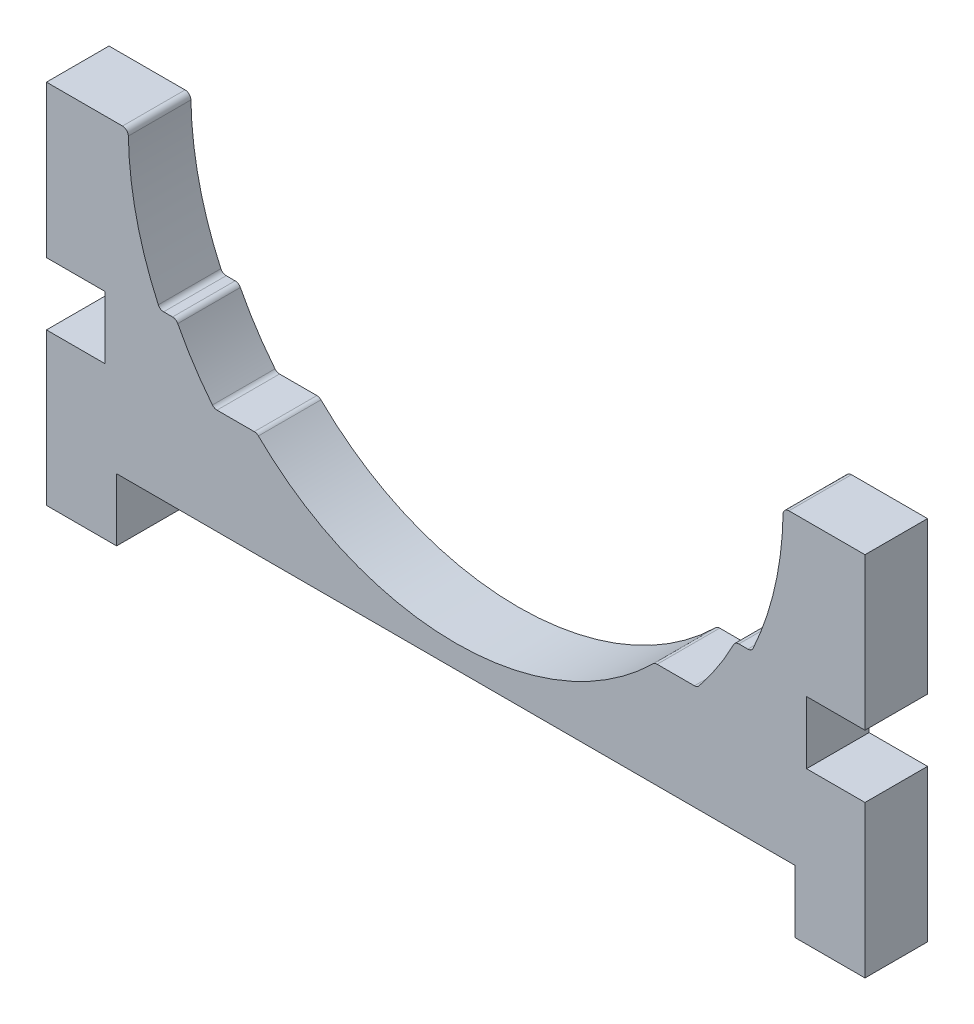
from build123d import *

# Parameters (mm, degrees)
BOSS_EXTRUDE1_DEPTH = 5.35


with BuildPart() as part:
    # Model → Boss-Extrude1 (new body)
    with BuildSketch(Plane.XY):
        with BuildLine():
            Line((-29, 0), (29, 0))
            Line((29, 0), (29, -5.35))
            Line((29, -5.35), (35, -5.35))
            Line((35, -5.35), (35, -1.30660388))
            Line((35, -1.30660388), (35, 7.65))
            Line((35, 7.65), (30, 7.65))
            Line((30, 7.65), (30, 13))
            Line((30, 13), (35, 13))
            Line((35, 13), (35, 26))
            Line((35, 26), (28.495613698, 26))
            ThreePointArc((28.495613698, 26), (28.145175376, 25.856641252), (27.99569065, 25.50877193))
            ThreePointArc((27.99569065, 25.50877193), (27.297393866, 19.766839637), (25.434173666, 14.290909091))
            ThreePointArc((25.434173666, 14.290909091), (25.249671939, 14.078962321), (24.979991994, 14))
            Line((24.979991994, 14), (24.213890642, 14))
            ThreePointArc((24.213890642, 14), (23.953774224, 13.927012236), (23.76959907, 13.729357798))
            ThreePointArc((23.76959907, 13.729357798), (22.402719166, 11.382179575), (20.804862314, 9.185714286))
            ThreePointArc((20.804862314, 9.185714286), (20.631459285, 9.048811094), (20.415986383, 9))
            Line((20.415986383, 9), (17.224924528, 9))
            ThreePointArc((17.224924528, 9), (17.035413911, 8.962693987), (16.874182835, 8.856342904))
            ThreePointArc((16.874182835, 8.856342904), (0, 1.945), (-16.874182835, 8.856342904))
            ThreePointArc((-16.874182835, 8.856342904), (-17.035413911, 8.962693987), (-17.224924528, 9))
            Line((-17.224924528, 9), (-20.415986383, 9))
            ThreePointArc((-20.415986383, 9), (-20.631459285, 9.048811094), (-20.804862314, 9.185714286))
            ThreePointArc((-20.804862314, 9.185714286), (-22.402719166, 11.382179575), (-23.76959907, 13.729357798))
            ThreePointArc((-23.76959907, 13.729357798), (-23.953774224, 13.927012236), (-24.213890642, 14))
            Line((-24.213890642, 14), (-24.979991994, 14))
            ThreePointArc((-24.979991994, 14), (-25.249671939, 14.078962321), (-25.434173666, 14.290909091))
            ThreePointArc((-25.434173666, 14.290909091), (-27.297393866, 19.766839637), (-27.99569065, 25.50877193))
            ThreePointArc((-27.99569065, 25.50877193), (-28.145175376, 25.856641252), (-28.495613698, 26))
            Line((-28.495613698, 26), (-35, 26))
            Line((-35, 26), (-35, 13))
            Line((-35, 13), (-30, 13))
            Line((-30, 13), (-30, 7.65))
            Line((-30, 7.65), (-35, 7.65))
            Line((-35, 7.65), (-35, -1.30660388))
            Line((-35, -1.30660388), (-35, -5.35))
            Line((-35, -5.35), (-29, -5.35))
            Line((-29, -5.35), (-29, 0))
        make_face()
    extrude(amount=BOSS_EXTRUDE1_DEPTH)


solid = part.part
